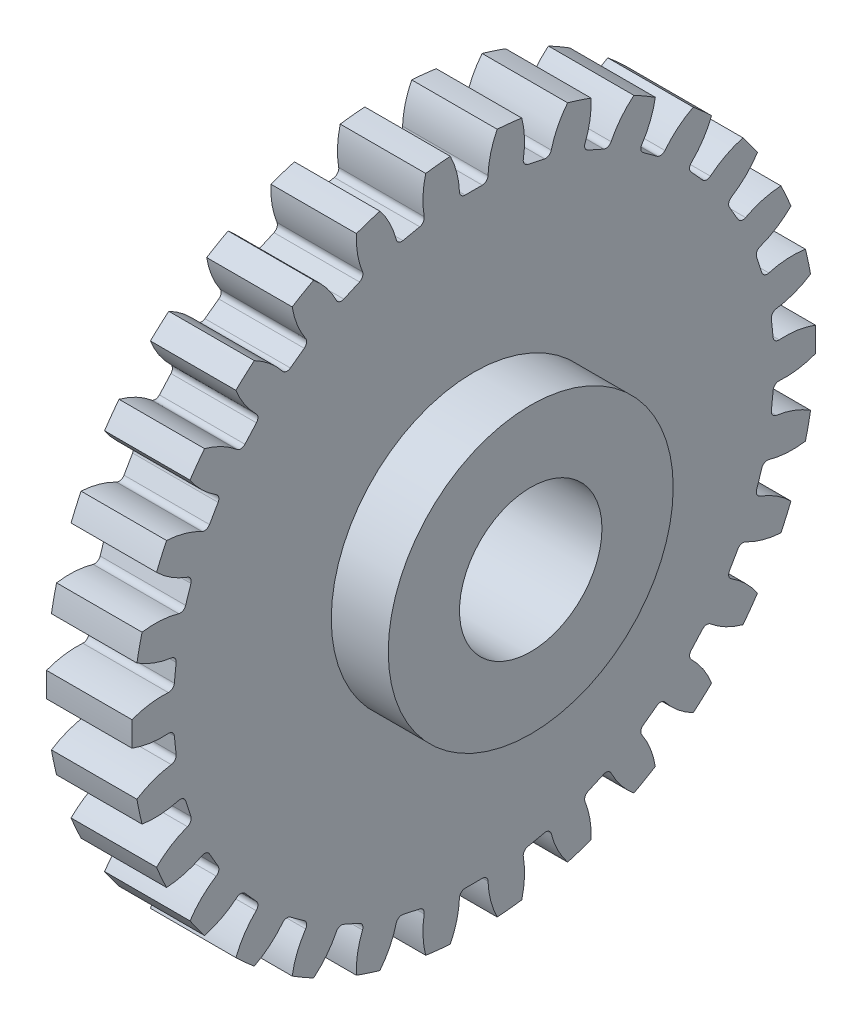
from build123d import *

# Parameters (mm, degrees)
SKETCH1_R           = 18
BOSS_EXTRUDE1_DEPTH = 2.25
SKETCH2_R           = 7.5
SKETCH2_R_2         = 3.75
BOSS_EXTRUDE2_DEPTH = 3
CUT_EXTRUDE1_START  = -2.5
SKETCH2_2_R         = 3.75
SKETCH2_2_R_2       = 2.25
CUT_EXTRUDE1_DEPTH  = 2.5
SKETCH2_4_R         = 2.25
CUT_EXTRUDE2_DEPTH  = 26.850531909
CUT_EXTRUDE3_DEPTH  = 26.850531909
CIRPATTERN1_COUNT   = 30


with BuildPart() as part:
    # Sketch1 → Boss-Extrude1 (new, symmetric)
    with BuildSketch(Plane(origin=(0, 0, 0), x_dir=(0, 0, -1), z_dir=(1, 0, 0))):
        Circle(SKETCH1_R)
    extrude(amount=BOSS_EXTRUDE1_DEPTH, both=True)

    # Sketch2 → Boss-Extrude2 (add)
    with BuildSketch(Plane(origin=(2.25, 0, 0), x_dir=(0, 0, -1), z_dir=(1, 0, 0))):
        Circle(SKETCH2_R)
        Circle(SKETCH2_R_2, mode=Mode.SUBTRACT)
    extrude(amount=BOSS_EXTRUDE2_DEPTH)

    # Sketch2<2> → Cut-Extrude1 (cut)
    with BuildSketch(Plane(origin=(2.25, 0, 0), x_dir=(0, 0, -1), z_dir=(1, 0, 0)).offset(CUT_EXTRUDE1_START)):
        Circle(SKETCH2_2_R)
        Circle(SKETCH2_2_R_2, mode=Mode.SUBTRACT)
    extrude(amount=CUT_EXTRUDE1_DEPTH, mode=Mode.SUBTRACT)

    # Sketch2<4> → Cut-Extrude2 (cut, through all)
    with BuildSketch(Plane(origin=(2.25, 0, 0), x_dir=(0, 0, -1), z_dir=(1, 0, 0))):
        Circle(SKETCH2_4_R)
    extrude(amount=-CUT_EXTRUDE2_DEPTH, mode=Mode.SUBTRACT)

    # Sketch3 → Cut-Extrude3 (cut, through all)
    with BuildSketch(Plane(origin=(2.25, 0, 0), x_dir=(0, 0, -1), z_dir=(1, 0, 0))):
        with BuildLine():
            Line((-0.452339818, 15.8), (0.452339818, 15.8))
            ThreePointArc((0.452339818, 15.8), (0.660301019, 15.883777571), (0.752112325, 16.088319074))
            ThreePointArc((0.752112325, 16.088319074), (1.115193464, 17.701993474), (2.03, 19.08))
            Line((2.03, 19.08), (-2.03, 19.08))
            ThreePointArc((-2.03, 19.08), (-1.115193464, 17.701993474), (-0.752112325, 16.088319074))
            ThreePointArc((-0.752112325, 16.088319074), (-0.660301019, 15.883777571), (-0.452339818, 15.8))
        make_face()
    cut_extrude3 = extrude(amount=-CUT_EXTRUDE3_DEPTH, mode=Mode.SUBTRACT)

    # CirPattern1: Cut-Extrude3 ×30 about axis
    cirpattern1_axis = Axis((2.25, 0, 0), (-1, 0, 0))
    for i in range(1, CIRPATTERN1_COUNT):
        add(cut_extrude3.rotate(cirpattern1_axis, i * 360 / CIRPATTERN1_COUNT), mode=Mode.SUBTRACT)


solid = part.part
